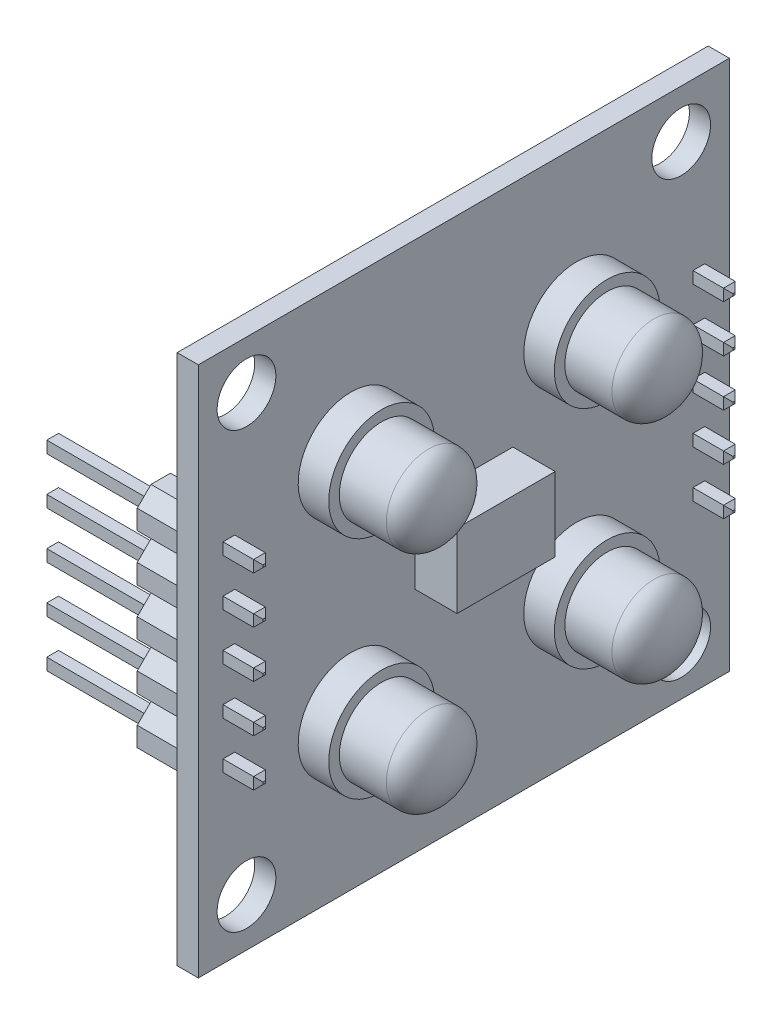
from build123d import *

# Parameters (mm, degrees)
SKETCH1_W                = 28.702
SKETCH1_H                = 28.702
SKETCH1_R                = 1.5875
BOSS_EXTRUDE1_DEPTH      = 1.143
BOSS_EXTRUDE2_DEPTH      = 1.905
BOSS_EXTRUDE2_DEPTH_BACK = 9.779
SKETCH2_W                = 0.635
SKETCH2_H                = 0.635
CHAMFER1_SIZE            = 0.254
LPATTERN2_COUNT          = 2
LPATTERN2_PITCH          = 25.4
LPATTERN2_2_COUNT        = 5
LPATTERN2_2_PITCH        = 2.54
SKETCH3_W                = 5.3
SKETCH3_H                = 4
BOSS_EXTRUDE3_DEPTH      = 2.286
SKETCH4_R                = 2.8575
BOSS_EXTRUDE4_DEPTH      = 1.651
SKETCH5_R                = 2.286
BOSS_EXTRUDE5_DEPTH      = 2.54
DOME2_FACE_RADIUS        = 2.286
DOME2_HEIGHT             = 1.27
LPATTERN1_COUNT          = 2
LPATTERN1_PITCH          = 12.192
LPATTERN1_2_COUNT        = 2
LPATTERN1_2_PITCH        = 12.192
SKETCH6_W                = 0.127
SKETCH6_H                = 0.127
SKETCH6_W_2              = 0.635
SKETCH6_H_2              = 0.635
BOSS_EXTRUDE6_DEPTH      = 2.54
BOSS_EXTRUDE6_2_DEPTH    = 2.54
BODY_MOVE_COPY1_ANGLE    = 120
SKETCH7_R                = 0.3175
BOSS_EXTRUDE7_DEPTH      = 0.5
BOSS_EXTRUDE7_2_DEPTH    = 0.5
BOSS_EXTRUDE7_3_DEPTH    = 0.5
BOSS_EXTRUDE7_4_DEPTH    = 0.5
BOSS_EXTRUDE7_5_DEPTH    = 0.5
BOSS_EXTRUDE7_6_DEPTH    = 0.5
BOSS_EXTRUDE7_7_DEPTH    = 0.5
BOSS_EXTRUDE7_8_DEPTH    = 0.5


with BuildPart() as part:
    # Sketch1 → Boss-Extrude1 (new body)
    with BuildSketch(Plane(origin=(0, 0, 0), x_dir=(1, 0, 0), z_dir=(0, 1, 0))):
        Rectangle(SKETCH1_W, SKETCH1_H)
        with Locations(Location((-11.7475, 11.7475, 0), (0, 0, 270))):
            Circle(SKETCH1_R, mode=Mode.SUBTRACT)
        with Locations(Location((11.7475, 11.7475, 0), (0, 0, 270))):
            Circle(SKETCH1_R, mode=Mode.SUBTRACT)
        with Locations(Location((11.7475, -11.7475, 0), (0, 0, 270))):
            Circle(SKETCH1_R, mode=Mode.SUBTRACT)
        with Locations(Location((-11.7475, -11.7475, 0), (0, 0, 270))):
            Circle(SKETCH1_R, mode=Mode.SUBTRACT)
    extrude(amount=BOSS_EXTRUDE1_DEPTH)


with BuildPart() as body_2:
    # Sketch2 → Boss-Extrude2 (new, two sides: drawn at the far end of the back side and taken through both)
    with BuildSketch(Plane(origin=(0, 1.143, 0), x_dir=(1, 0, 0), z_dir=(0, 1, 0)).offset(-BOSS_EXTRUDE2_DEPTH_BACK)):
        with Locations((-12.7, -5.08)):
            Rectangle(SKETCH2_W, SKETCH2_H)
    extrude(amount=BOSS_EXTRUDE2_DEPTH + BOSS_EXTRUDE2_DEPTH_BACK)

    # Chamfer1
    chamfer1_edges = [body_2.edges().sort_by_distance(p)[0] for p in [
        (-12.3825, 3.048, 5.08),
        (-13.0175, -8.636, 5.08),
        (-12.7, 3.048, 4.7625),
        (-13.0175, 3.048, 5.08),
        (-12.7, 3.048, 5.3975),
        (-12.7, -8.636, 5.3975),
        (-12.3825, -8.636, 5.08),
        (-12.7, -8.636, 4.7625),
    ]]
    chamfer(chamfer1_edges, length=CHAMFER1_SIZE)


with BuildPart() as lpattern2_1:
    # LPattern2: pattern copy
    add(body_2.part.moved(Location(Vector(1, 0, 0) * (1 * LPATTERN2_PITCH))))


with BuildPart() as lpattern2_2_1:
    # LPattern2 2: pattern copy
    add(body_2.part.moved(Location(Vector(0, 0, -1) * (1 * LPATTERN2_2_PITCH))))


with BuildPart() as lpattern2_2_2:
    # LPattern2 2: pattern copy
    add(body_2.part.moved(Location(Vector(0, 0, -1) * (2 * LPATTERN2_2_PITCH))))


with BuildPart() as lpattern2_2_3:
    # LPattern2 2: pattern copy
    add(body_2.part.moved(Location(Vector(0, 0, -1) * (3 * LPATTERN2_2_PITCH))))


with BuildPart() as lpattern2_2_4:
    # LPattern2 2: pattern copy
    add(body_2.part.moved(Location(Vector(0, 0, -1) * (4 * LPATTERN2_2_PITCH))))


with BuildPart() as lpattern2_2_5:
    # LPattern2 2: pattern copy
    add(lpattern2_1.part.moved(Location(Vector(0, 0, -1) * (1 * LPATTERN2_2_PITCH))))


with BuildPart() as lpattern2_2_6:
    # LPattern2 2: pattern copy
    add(lpattern2_1.part.moved(Location(Vector(0, 0, -1) * (2 * LPATTERN2_2_PITCH))))


with BuildPart() as lpattern2_2_7:
    # LPattern2 2: pattern copy
    add(lpattern2_1.part.moved(Location(Vector(0, 0, -1) * (3 * LPATTERN2_2_PITCH))))


with BuildPart() as lpattern2_2_8:
    # LPattern2 2: pattern copy
    add(lpattern2_1.part.moved(Location(Vector(0, 0, -1) * (4 * LPATTERN2_2_PITCH))))


with BuildPart() as body_12:
    # Sketch3 → Boss-Extrude3 (new body)
    with BuildSketch(Plane(origin=(0, 1.143, 0), x_dir=(1, 0, 0), z_dir=(0, 1, 0))):
        Rectangle(SKETCH3_W, SKETCH3_H)
    extrude(amount=BOSS_EXTRUDE3_DEPTH)


with BuildPart() as body_13:
    # Sketch4 → Boss-Extrude4 (new body)
    with BuildSketch(Plane(origin=(0, 1.143, 0), x_dir=(1, 0, 0), z_dir=(0, 1, 0))):
        with Locations(Location((-6.096, 6.096, 0), (0, 0, 90))):
            Circle(SKETCH4_R)
    extrude(amount=BOSS_EXTRUDE4_DEPTH)

    # Sketch5 → Boss-Extrude5 (add)
    with BuildSketch(Plane(origin=(0, 2.794, 0), x_dir=(1, 0, 0), z_dir=(0, 1, 0))):
        with Locations(Location((-6.096, 6.096, 0), (0, 0, 270))):
            Circle(SKETCH5_R)
    extrude(amount=BOSS_EXTRUDE5_DEPTH)

    # Dome2: an elliptical dome of height H over a round flat face of radius A is half a spheroid: the quarter ellipse of half axes A and H revolved about the face's axis
    with BuildSketch(Plane((-6.096, 5.334, -6.096), x_dir=(0, 0, -1), z_dir=(1, 0, 0)), mode=Mode.PRIVATE) as dome2_quarter:
        Ellipse(DOME2_FACE_RADIUS, DOME2_HEIGHT)
        Rectangle(DOME2_FACE_RADIUS, DOME2_HEIGHT, align=(Align.MIN, Align.MIN), mode=Mode.INTERSECT)
    revolve(dome2_quarter.sketch, axis=Axis((-6.096, 5.334, -6.096), (0, 1, 0)))


with BuildPart() as lpattern1_1:
    # LPattern1: pattern copy
    add(body_13.part.moved(Location(Vector(1, 0, 0) * (1 * LPATTERN1_PITCH))))


with BuildPart() as lpattern1_2_1:
    # LPattern1 2: pattern copy
    add(body_13.part.moved(Location(Vector(0, 0, 1) * (1 * LPATTERN1_2_PITCH))))


with BuildPart() as lpattern1_2_2:
    # LPattern1 2: pattern copy
    add(lpattern1_1.part.moved(Location(Vector(0, 0, 1) * (1 * LPATTERN1_2_PITCH))))


with BuildPart() as body_17:
    # Sketch6 → Boss-Extrude6 (new body)
    with BuildSketch(Plane.XZ):
        Polygon((-11.43, 4.553948776), (-11.43, 5.606051224), (-12.173948776, 6.35), (-13.226051224, 6.35), (-13.97, 5.606051224), (-13.97, 4.553948776), (-13.226051224, 3.81), (-13.97, 3.066051224), (-13.97, 2.013948776), (-13.226051224, 1.27), (-13.97, 0.526051224), (-13.97, -0.526051224), (-13.226051224, -1.27), (-13.97, -2.013948776), (-13.97, -3.066051224), (-13.226051224, -3.81), (-13.97, -4.553948776), (-13.97, -5.606051224), (-13.226051224, -6.35), (-12.173948776, -6.35), (-11.43, -5.606051224), (-11.43, -4.553948776), (-12.173948776, -3.81), (-11.43, -3.066051224), (-11.43, -2.013948776), (-12.173948776, -1.27), (-11.43, -0.526051224), (-11.43, 0.526051224), (-12.173948776, 1.27), (-11.43, 2.013948776), (-11.43, 3.066051224), (-12.173948776, 3.81), align=None)
        with Locations((-12.7, 5.08)):
            Rectangle(SKETCH6_W, SKETCH6_H, mode=Mode.SUBTRACT)
        with Locations((-12.7, 2.54)):
            Rectangle(SKETCH6_W_2, SKETCH6_H_2, mode=Mode.SUBTRACT)
        with Locations((-12.7, 0)):
            Rectangle(SKETCH6_W_2, SKETCH6_H_2, mode=Mode.SUBTRACT)
        with Locations((-12.7, -2.54)):
            Rectangle(SKETCH6_W_2, SKETCH6_H_2, mode=Mode.SUBTRACT)
        with Locations((-12.7, -5.08)):
            Rectangle(SKETCH6_W_2, SKETCH6_H_2, mode=Mode.SUBTRACT)
    extrude(amount=BOSS_EXTRUDE6_DEPTH)


with BuildPart() as body_18:
    # Sketch6 → Boss-Extrude6 2 (new body)
    with BuildSketch(Plane.XZ):
        Polygon((13.97, 4.553948776), (13.97, 5.606051224), (13.226051224, 6.35), (12.173948776, 6.35), (11.43, 5.606051224), (11.43, 4.553948776), (12.173948776, 3.81), (11.43, 3.066051224), (11.43, 2.013948776), (12.173948776, 1.27), (11.43, 0.526051224), (11.43, -0.526051224), (12.173948776, -1.27), (11.43, -2.013948776), (11.43, -3.066051224), (12.173948776, -3.81), (11.43, -4.553948776), (11.43, -5.606051224), (12.173948776, -6.35), (13.226051224, -6.35), (13.97, -5.606051224), (13.97, -4.553948776), (13.226051224, -3.81), (13.97, -3.066051224), (13.97, -2.013948776), (13.226051224, -1.27), (13.97, -0.526051224), (13.97, 0.526051224), (13.226051224, 1.27), (13.97, 2.013948776), (13.97, 3.066051224), (13.226051224, 3.81), align=None)
        with Locations((12.7, 5.08)):
            Rectangle(SKETCH6_W_2, SKETCH6_H_2, mode=Mode.SUBTRACT)
        with Locations((12.7, 2.54)):
            Rectangle(SKETCH6_W_2, SKETCH6_H_2, mode=Mode.SUBTRACT)
        with Locations((12.7, 0)):
            Rectangle(SKETCH6_W_2, SKETCH6_H_2, mode=Mode.SUBTRACT)
        with Locations((12.7, -2.54)):
            Rectangle(SKETCH6_W_2, SKETCH6_H_2, mode=Mode.SUBTRACT)
        with Locations((12.7, -5.08)):
            Rectangle(SKETCH6_W_2, SKETCH6_H_2, mode=Mode.SUBTRACT)
    extrude(amount=BOSS_EXTRUDE6_2_DEPTH)


with BuildPart() as lpattern1_2_2_1:
    # Body-Move/Copy1: moved
    add(lpattern1_2_2.part.moved(Location((0, 0, 0))).rotate(Axis((0.338666667, -0.677333333, -0.338666667), (0.5773502691896245, 0.5773502691896305, -0.5773502691896225)), BODY_MOVE_COPY1_ANGLE))


with BuildPart() as body_17_1:
    # Body-Move/Copy1: moved
    add(body_17.part.moved(Location((0, 0, 0))).rotate(Axis((0.338666667, -0.677333333, -0.338666667), (0.5773502691896245, 0.5773502691896305, -0.5773502691896225)), BODY_MOVE_COPY1_ANGLE))


with BuildPart() as body_2_1:
    # Body-Move/Copy1: moved
    add(body_2.part.moved(Location((0, 0, 0))).rotate(Axis((0.338666667, -0.677333333, -0.338666667), (0.5773502691896245, 0.5773502691896305, -0.5773502691896225)), BODY_MOVE_COPY1_ANGLE))


with BuildPart() as body_13_1:
    # Body-Move/Copy1: moved
    add(body_13.part.moved(Location((0, 0, 0))).rotate(Axis((0.338666667, -0.677333333, -0.338666667), (0.5773502691896245, 0.5773502691896305, -0.5773502691896225)), BODY_MOVE_COPY1_ANGLE))


with BuildPart() as lpattern2_2_5_1:
    # Body-Move/Copy1: moved
    add(lpattern2_2_5.part.moved(Location((0, 0, 0))).rotate(Axis((0.338666667, -0.677333333, -0.338666667), (0.5773502691896245, 0.5773502691896305, -0.5773502691896225)), BODY_MOVE_COPY1_ANGLE))


with BuildPart() as lpattern2_2_3_1:
    # Body-Move/Copy1: moved
    add(lpattern2_2_3.part.moved(Location((0, 0, 0))).rotate(Axis((0.338666667, -0.677333333, -0.338666667), (0.5773502691896245, 0.5773502691896305, -0.5773502691896225)), BODY_MOVE_COPY1_ANGLE))


with BuildPart() as body_18_1:
    # Body-Move/Copy1: moved
    add(body_18.part.moved(Location((0, 0, 0))).rotate(Axis((0.338666667, -0.677333333, -0.338666667), (0.5773502691896245, 0.5773502691896305, -0.5773502691896225)), BODY_MOVE_COPY1_ANGLE))


with BuildPart() as lpattern2_2_8_1:
    # Body-Move/Copy1: moved
    add(lpattern2_2_8.part.moved(Location((0, 0, 0))).rotate(Axis((0.338666667, -0.677333333, -0.338666667), (0.5773502691896245, 0.5773502691896305, -0.5773502691896225)), BODY_MOVE_COPY1_ANGLE))


with BuildPart() as lpattern2_1_1:
    # Body-Move/Copy1: moved
    add(lpattern2_1.part.moved(Location((0, 0, 0))).rotate(Axis((0.338666667, -0.677333333, -0.338666667), (0.5773502691896245, 0.5773502691896305, -0.5773502691896225)), BODY_MOVE_COPY1_ANGLE))


with BuildPart() as lpattern2_2_2_1:
    # Body-Move/Copy1: moved
    add(lpattern2_2_2.part.moved(Location((0, 0, 0))).rotate(Axis((0.338666667, -0.677333333, -0.338666667), (0.5773502691896245, 0.5773502691896305, -0.5773502691896225)), BODY_MOVE_COPY1_ANGLE))


with BuildPart() as lpattern1_1_1:
    # Body-Move/Copy1: moved
    add(lpattern1_1.part.moved(Location((0, 0, 0))).rotate(Axis((0.338666667, -0.677333333, -0.338666667), (0.5773502691896245, 0.5773502691896305, -0.5773502691896225)), BODY_MOVE_COPY1_ANGLE))


with BuildPart() as lpattern2_2_7_1:
    # Body-Move/Copy1: moved
    add(lpattern2_2_7.part.moved(Location((0, 0, 0))).rotate(Axis((0.338666667, -0.677333333, -0.338666667), (0.5773502691896245, 0.5773502691896305, -0.5773502691896225)), BODY_MOVE_COPY1_ANGLE))


with BuildPart() as body_12_1:
    # Body-Move/Copy1: moved
    add(body_12.part.moved(Location((0, 0, 0))).rotate(Axis((0.338666667, -0.677333333, -0.338666667), (0.5773502691896245, 0.5773502691896305, -0.5773502691896225)), BODY_MOVE_COPY1_ANGLE))


with BuildPart() as part_1:
    # Body-Move/Copy1: moved
    add(part.part.moved(Location((0, 0, 0))).rotate(Axis((0.338666667, -0.677333333, -0.338666667), (0.5773502691896245, 0.5773502691896305, -0.5773502691896225)), BODY_MOVE_COPY1_ANGLE))


with BuildPart() as lpattern2_2_1_1:
    # Body-Move/Copy1: moved
    add(lpattern2_2_1.part.moved(Location((0, 0, 0))).rotate(Axis((0.338666667, -0.677333333, -0.338666667), (0.5773502691896245, 0.5773502691896305, -0.5773502691896225)), BODY_MOVE_COPY1_ANGLE))


with BuildPart() as lpattern2_2_6_1:
    # Body-Move/Copy1: moved
    add(lpattern2_2_6.part.moved(Location((0, 0, 0))).rotate(Axis((0.338666667, -0.677333333, -0.338666667), (0.5773502691896245, 0.5773502691896305, -0.5773502691896225)), BODY_MOVE_COPY1_ANGLE))


with BuildPart() as lpattern2_2_4_1:
    # Body-Move/Copy1: moved
    add(lpattern2_2_4.part.moved(Location((0, 0, 0))).rotate(Axis((0.338666667, -0.677333333, -0.338666667), (0.5773502691896245, 0.5773502691896305, -0.5773502691896225)), BODY_MOVE_COPY1_ANGLE))


with BuildPart() as lpattern1_2_1_1:
    # Body-Move/Copy1: moved
    add(lpattern1_2_1.part.moved(Location((0, 0, 0))).rotate(Axis((0.338666667, -0.677333333, -0.338666667), (0.5773502691896245, 0.5773502691896305, -0.5773502691896225)), BODY_MOVE_COPY1_ANGLE))


with BuildPart() as body_19:
    # Sketch7 → Boss-Extrude7 (new body)
    with BuildSketch(Plane.ZY.offset(-1.016)):
        with Locations(Location((4.826, 5.08, 0), (0, 0, 270))):
            Circle(SKETCH7_R)
    extrude(amount=BOSS_EXTRUDE7_DEPTH)


with BuildPart() as body_20:
    # Sketch7 → Boss-Extrude7 2 (new body)
    with BuildSketch(Plane.ZY.offset(-1.016)):
        with Locations(Location((7.366, 5.08, 0), (0, 0, 270))):
            Circle(SKETCH7_R)
    extrude(amount=BOSS_EXTRUDE7_2_DEPTH)


with BuildPart() as body_21:
    # Sketch7 → Boss-Extrude7 3 (new body)
    with BuildSketch(Plane.ZY.offset(-1.016)):
        with Locations(Location((-4.826, 5.08, 0), (0, 0, 270))):
            Circle(SKETCH7_R)
    extrude(amount=BOSS_EXTRUDE7_3_DEPTH)


with BuildPart() as body_22:
    # Sketch7 → Boss-Extrude7 4 (new body)
    with BuildSketch(Plane.ZY.offset(-1.016)):
        with Locations(Location((-7.366, 5.08, 0), (0, 0, 270))):
            Circle(SKETCH7_R)
    extrude(amount=BOSS_EXTRUDE7_4_DEPTH)


with BuildPart() as body_23:
    # Sketch7 → Boss-Extrude7 5 (new body)
    with BuildSketch(Plane.ZY.offset(-1.016)):
        with Locations(Location((-4.826, -7.112, 0), (0, 0, 270))):
            Circle(SKETCH7_R)
    extrude(amount=BOSS_EXTRUDE7_5_DEPTH)


with BuildPart() as body_24:
    # Sketch7 → Boss-Extrude7 6 (new body)
    with BuildSketch(Plane.ZY.offset(-1.016)):
        with Locations(Location((-7.366, -7.112, 0), (0, 0, 270))):
            Circle(SKETCH7_R)
    extrude(amount=BOSS_EXTRUDE7_6_DEPTH)


with BuildPart() as body_25:
    # Sketch7 → Boss-Extrude7 7 (new body)
    with BuildSketch(Plane.ZY.offset(-1.016)):
        with Locations(Location((7.366, -7.112, 0), (0, 0, 270))):
            Circle(SKETCH7_R)
    extrude(amount=BOSS_EXTRUDE7_7_DEPTH)


with BuildPart() as body_26:
    # Sketch7 → Boss-Extrude7 8 (new body)
    with BuildSketch(Plane.ZY.offset(-1.016)):
        with Locations(Location((4.826, -7.112, 0), (0, 0, 270))):
            Circle(SKETCH7_R)
    extrude(amount=BOSS_EXTRUDE7_8_DEPTH)


solid = Compound([lpattern1_2_2_1.part, body_17_1.part, body_2_1.part, body_13_1.part, lpattern2_2_5_1.part, lpattern2_2_3_1.part, body_18_1.part, lpattern2_2_8_1.part, lpattern2_1_1.part, lpattern2_2_2_1.part, lpattern1_1_1.part, lpattern2_2_7_1.part, body_12_1.part, part_1.part, lpattern2_2_1_1.part, lpattern2_2_6_1.part, lpattern2_2_4_1.part, lpattern1_2_1_1.part, body_19.part, body_20.part, body_21.part, body_22.part, body_23.part, body_24.part, body_25.part, body_26.part])
